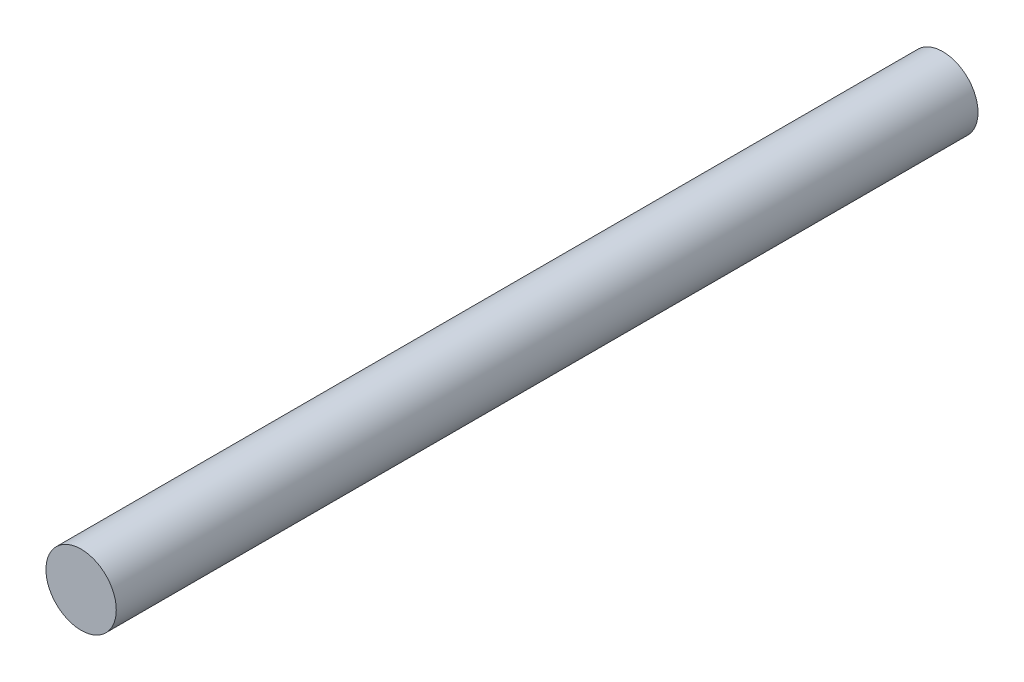
from build123d import *

# Parameters (mm, degrees)
SHAFT_START    = -49
SHAFT_SKETCH_R = 4
SHAFT_DEPTH    = 98


with BuildPart() as part:
    # Shaft_Sketch → Shaft (new body)
    with BuildSketch(Plane.XY.offset(SHAFT_START)):
        Circle(SHAFT_SKETCH_R)
    extrude(amount=SHAFT_DEPTH)


solid = part.part
